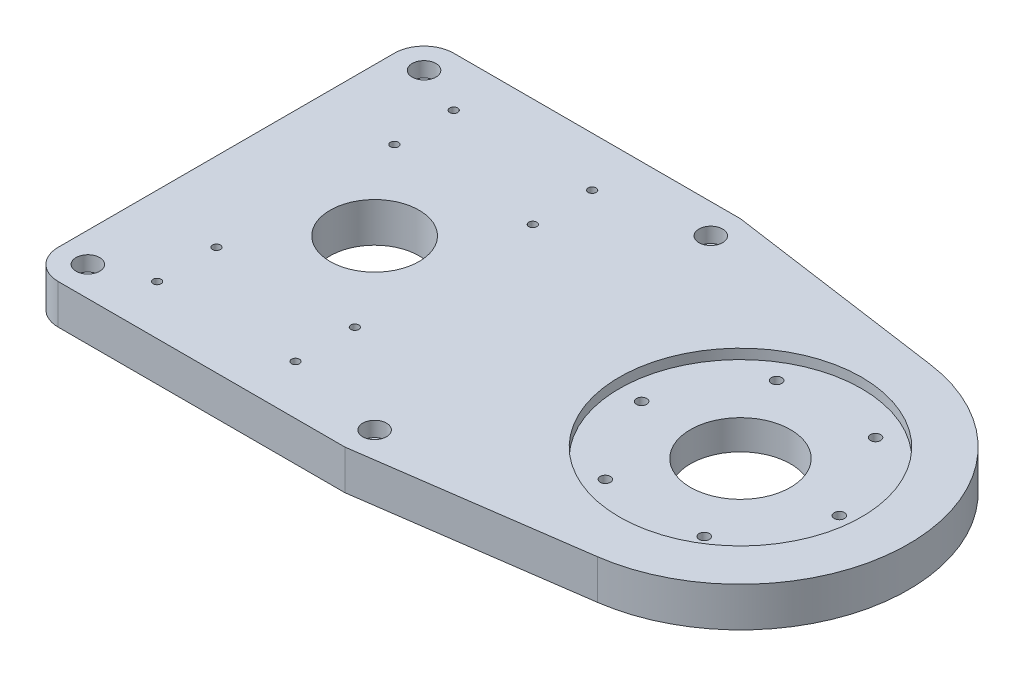
from build123d import *

# Parameters (mm, degrees)
SKETCH1_R                                           = 28.575
SKETCH1_R_2                                         = 32.1437
BOSS_EXTRUDE1_DEPTH                                 = 25.4
CBORE_FOR_00_BINDING_HEAD_MACHINE_SCREW_D           = 10.16
CBORE_FOR_00_BINDING_HEAD_MACHINE_SCREW_CBORE_D     = 15.24
CBORE_FOR_00_BINDING_HEAD_MACHINE_SCREW_CBORE_DEPTH = 9.652
F_1_4_20_TAPPED_HOLE1_D                             = 5.1054
F_1_4_20_TAPPED_HOLE1_DEPTH                         = 17.516183098
F_1_4_20_TAPPED_HOLE1_TIP                           = 1.533816902
SKETCH5_R                                           = 77.7875
CUT_EXTRUDE1_DEPTH                                  = 6.35
F_5_16_18_TAPPED_HOLE1_D                            = 6.604
CIRPATTERN1_COUNT                                   = 6


with BuildPart() as part:
    # Sketch1 → Boss-Extrude1 (new body)
    with BuildSketch(Plane(origin=(0, 0, 0), x_dir=(1, 0, 0), z_dir=(0, 1, 0))):
        with BuildLine():
            Line((-95.25, 107.95), (-95.25, -107.95))
            ThreePointArc((-95.25, -107.95), (-89.670384182, -121.420384182), (-76.2, -127))
            Line((-76.2, -127), (107.95, -127))
            Line((107.95, -127), (250.077327963, -106.884827963))
            ThreePointArc((250.077327963, -106.884827963), (342.9, 0), (250.077327963, 106.884827963))
            Line((250.077327963, 106.884827963), (107.95, 127))
            Line((107.95, 127), (-76.2, 127))
            ThreePointArc((-76.2, 127), (-89.670384182, 121.420384182), (-95.25, 107.95))
        make_face()
        with Locations(Location((0, 0, 0), (0, 0, 270))):
            Circle(SKETCH1_R, mode=Mode.SUBTRACT)
        with Locations(Location((234.95, 0, 0), (0, 0, 270))):
            Circle(SKETCH1_R_2, mode=Mode.SUBTRACT)
    extrude(amount=BOSS_EXTRUDE1_DEPTH)

    # CBORE for #00 Binding Head Machine Screw1 (through all)
    with Locations(Plane(origin=(-76.2, 25.4, -107.95), x_dir=(0, 0, 1), z_dir=(0, 1, 0))):
        with Locations((0, 0), (215.9, 0), (0, 184.15), (215.9, 184.15)):
            CounterBoreHole(CBORE_FOR_00_BINDING_HEAD_MACHINE_SCREW_D / 2, CBORE_FOR_00_BINDING_HEAD_MACHINE_SCREW_CBORE_D / 2, CBORE_FOR_00_BINDING_HEAD_MACHINE_SCREW_CBORE_DEPTH)

    # 1/4-20 Tapped Hole1
    with Locations(Plane(origin=(-44.45, 25.4, -95.25), x_dir=(0, 0, 1), z_dir=(0, 1, 0))):
        with Locations((0, 0), (0, 88.9), (38.1, 88.9), (38.1, 0), (152.4, 0), (152.4, 88.9), (190.5, 88.9), (190.5, 0)):
            Hole(F_1_4_20_TAPPED_HOLE1_D / 2, depth=F_1_4_20_TAPPED_HOLE1_DEPTH)
            with Locations((0, 0, -(F_1_4_20_TAPPED_HOLE1_DEPTH + F_1_4_20_TAPPED_HOLE1_TIP / 2))):  # 118° drill point
                Cone(0, F_1_4_20_TAPPED_HOLE1_D / 2, F_1_4_20_TAPPED_HOLE1_TIP, mode=Mode.SUBTRACT)

    # Sketch5 → Cut-Extrude1 (cut)
    with BuildSketch(Plane(origin=(0, 25.4, 0), x_dir=(1, 0, 0), z_dir=(0, 1, 0))):
        with Locations(Location((234.95, 0, 0), (0, 0, 270))):
            Circle(SKETCH5_R)
    extrude(amount=-CUT_EXTRUDE1_DEPTH, mode=Mode.SUBTRACT)

    # 5/16-18 Tapped Hole1 (through all)
    with Locations(Plane(origin=(298.45, 19.05, 0), x_dir=(0, 0, 1), z_dir=(0, 1, 0))):
        with Locations((0, 0)):
            f_5_16_18_tapped_hole1 = Hole(F_5_16_18_TAPPED_HOLE1_D / 2)

    # CirPattern1: 5/16-18 Tapped Hole1 ×6 about axis
    cirpattern1_axis = Axis((234.95, 0, 0), (0, 1, 0))
    for i in range(1, CIRPATTERN1_COUNT):
        add(f_5_16_18_tapped_hole1.rotate(cirpattern1_axis, i * 360 / CIRPATTERN1_COUNT), mode=Mode.SUBTRACT)


solid = part.part
